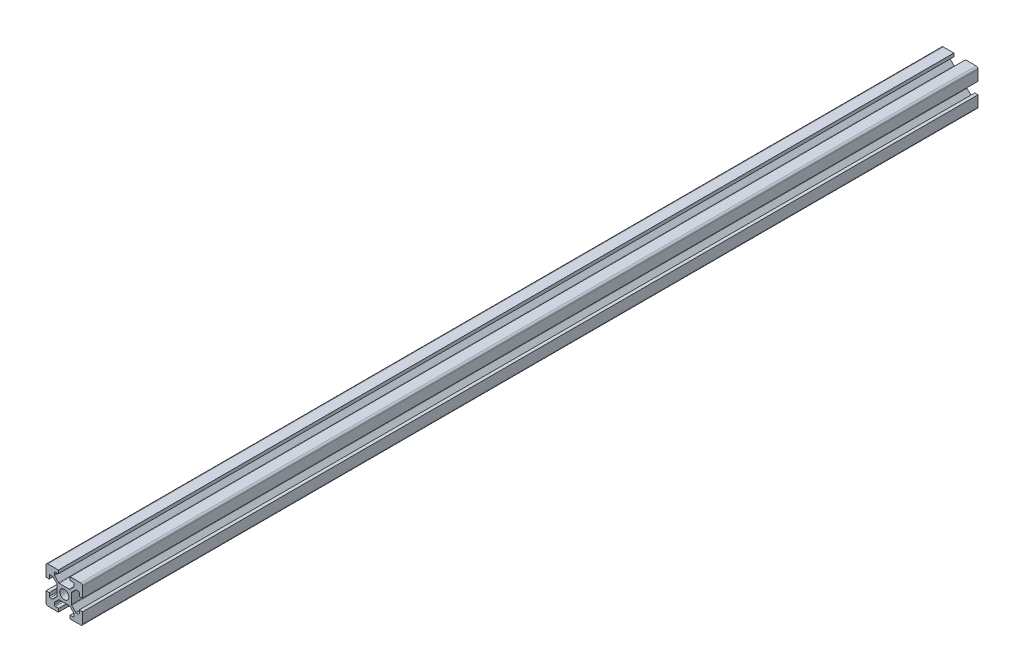
from build123d import *

# Parameters (mm, degrees)
SKETCH1_R           = 2.5
BOSS_EXTRUDE1_DEPTH = 490
FILLET1_R           = 1
FILLET2_R           = 0.5
FILLET3_R           = 0.5
FILLET4_R           = 0.5
FILLET5_R           = 0.5


with BuildPart() as part:
    # Sketch1 → Boss-Extrude1 (new body)
    with BuildSketch(Plane.XY):
        Polygon((13.2, 0), (13.2, 1.8), (15.45, 1.8), (15.45, 3.6), (12.95, 6.1), (7.05, 6.1), (4.55, 3.6), (4.55, 1.8), (6.8, 1.8), (6.8, 0), (0, 0), (0, 6.8), (1.8, 6.8), (1.8, 4.55), (3.6, 4.55), (6.1, 7.05), (6.1, 12.95), (3.6, 15.45), (1.8, 15.45), (1.8, 13.2), (0, 13.2), (0, 20), (6.8, 20), (6.8, 18.2), (4.55, 18.2), (4.55, 16.4), (7.05, 13.9), (12.95, 13.9), (15.45, 16.4), (15.45, 18.2), (13.2, 18.2), (13.2, 20), (20, 20), (20, 13.2), (18.2, 13.2), (18.2, 15.45), (16.4, 15.45), (13.9, 12.95), (13.9, 7.05), (16.4, 4.55), (18.2, 4.55), (18.2, 6.8), (20, 6.8), (20, 0), align=None)
        with Locations((10, 10)):
            Circle(SKETCH1_R, mode=Mode.SUBTRACT)
    extrude(amount=BOSS_EXTRUDE1_DEPTH)

    # Fillet1
    fillet1_edges = [part.edges().sort_by_distance(p)[0] for p in [
        (0, 0, 245),
        (0, 20, 245),
        (20, 20, 245),
        (20, 0, 245),
    ]]
    fillet(fillet1_edges, radius=FILLET1_R)

    # Fillet2
    fillet2_edges = [part.edges().sort_by_distance(p)[0] for p in [
        (4.55, 18.2, 245),
        (4.55, 16.4, 245),
        (7.05, 13.9, 245),
        (12.95, 13.9, 245),
        (15.45, 16.4, 245),
        (15.45, 18.2, 245),
    ]]
    fillet(fillet2_edges, radius=FILLET2_R)

    # Fillet3
    fillet3_edges = [part.edges().sort_by_distance(p)[0] for p in [
        (18.2, 15.45, 245),
        (16.4, 15.45, 245),
        (13.9, 12.95, 245),
        (13.9, 7.05, 245),
        (16.4, 4.55, 245),
        (18.2, 4.55, 245),
    ]]
    fillet(fillet3_edges, radius=FILLET3_R)

    # Fillet4
    fillet4_edges = [part.edges().sort_by_distance(p)[0] for p in [
        (1.8, 4.55, 245),
        (3.6, 4.55, 245),
        (6.1, 7.05, 245),
        (6.1, 12.95, 245),
        (3.6, 15.45, 245),
        (1.8, 15.45, 245),
    ]]
    fillet(fillet4_edges, radius=FILLET4_R)

    # Fillet5
    fillet5_edges = [part.edges().sort_by_distance(p)[0] for p in [
        (15.45, 1.8, 245),
        (15.45, 3.6, 245),
        (12.95, 6.1, 245),
        (7.05, 6.1, 245),
        (4.55, 3.6, 245),
        (4.55, 1.8, 245),
    ]]
    fillet(fillet5_edges, radius=FILLET5_R)


solid = part.part
